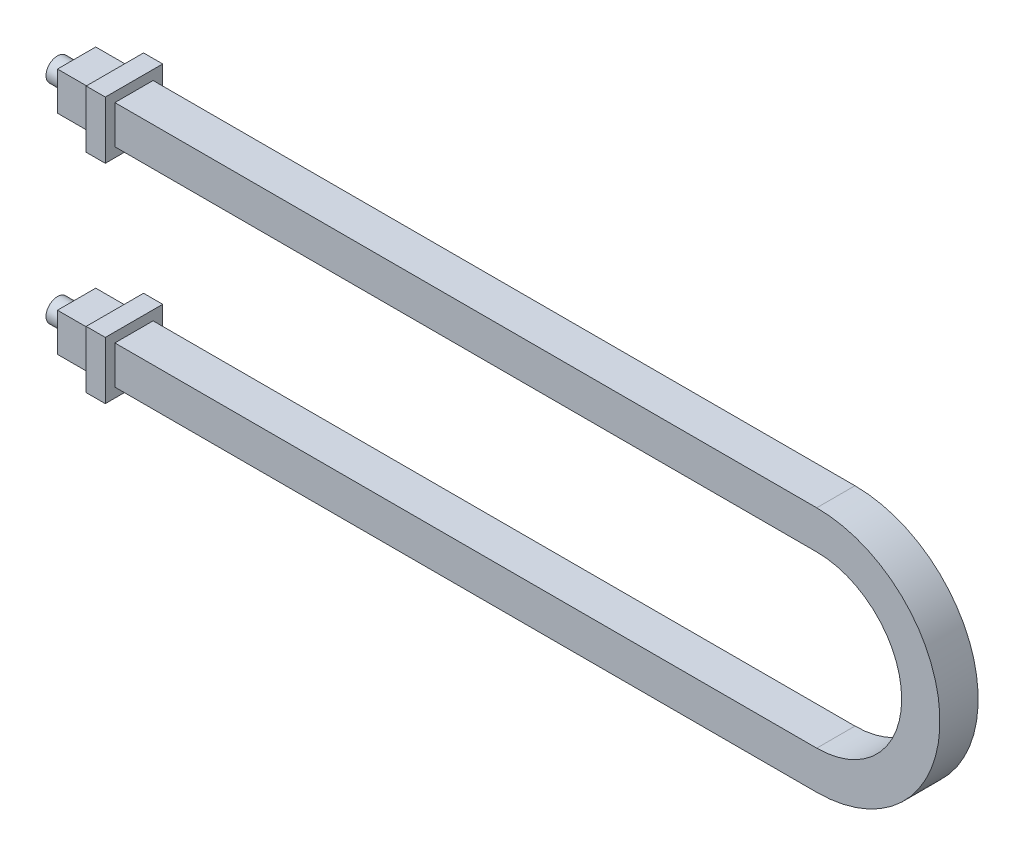
from build123d import *

# Parameters (mm, degrees)
BOSS_EXTRUDE1_DEPTH   = 10
SKETCH2_R             = 3
BOSS_EXTRUDE2_DEPTH   = 15
SKETCH3_R             = 3
BOSS_EXTRUDE3_DEPTH   = 15
SKETCH5_W             = 15
SKETCH5_H             = 15
BOSS_EXTRUDE4_DEPTH   = 5
BOSS_EXTRUDE4_2_DEPTH = 5
SKETCH7_W             = 10
SKETCH7_H             = 10
BOSS_EXTRUDE5_DEPTH   = 10


with BuildPart() as part:
    # Sketch1 → Boss-Extrude1 (new body)
    with BuildSketch(Plane.XY):
        with BuildLine():
            Line((0, 0), (188.467924539, 0))
            ThreePointArc((188.467924539, 0), (220.672766762, -32.204842223), (188.467924539, -64.409684446))
            Line((188.467924539, -64.409684446), (0, -64.409684446))
            Line((0, -64.409684446), (0, -54.409684446))
            Line((0, -54.409684446), (188.467924539, -54.409684446))
            ThreePointArc((188.467924539, -54.409684446), (210.672766762, -32.204842223), (188.467924539, -10))
            Line((188.467924539, -10), (0, -10))
            Line((0, -10), (0, 0))
        make_face()
    extrude(amount=BOSS_EXTRUDE1_DEPTH)

    # Sketch2 → Boss-Extrude2 (add)
    with BuildSketch(Plane.ZY):
        with Locations(Location((5, -4.906979909, 0), (0, 0, 180))):
            Circle(SKETCH2_R)
    extrude(amount=BOSS_EXTRUDE2_DEPTH)



with BuildPart() as body_2:
    # Sketch3 → Boss-Extrude3 (new body)
    with BuildSketch(Plane.ZY):
        with Locations((5, -59.409684446)):
            Circle(SKETCH3_R)
    extrude(amount=BOSS_EXTRUDE3_DEPTH)


with BuildPart() as body_3:
    # Sketch5 → Boss-Extrude4 (new body)
    with BuildSketch(Plane(origin=(0, 0, 0), x_dir=(0, 0, -1), z_dir=(1, 0, 0))):
        with Locations((-5, -59.409684446)):
            Rectangle(SKETCH5_W, SKETCH5_H)
    extrude(amount=BOSS_EXTRUDE4_DEPTH)


with BuildPart() as body_4:
    # Sketch5 → Boss-Extrude4 2 (new body)
    with BuildSketch(Plane(origin=(0, 0, 0), x_dir=(0, 0, -1), z_dir=(1, 0, 0))):
        with Locations((-5, -5)):
            Rectangle(SKETCH5_W, SKETCH5_H)
    extrude(amount=BOSS_EXTRUDE4_2_DEPTH)


with BuildPart() as part_1:
    add(part.part)

    add(body_2.part)  # Boss-Extrude5 merges body 2

    add(body_3.part)  # Boss-Extrude5 merges body 3

    add(body_4.part)  # Boss-Extrude5 merges body 4
    # Sketch7 → Boss-Extrude5 (add)
    with BuildSketch(Plane.ZY):
        with Locations((5, -59.502704537)):
            Rectangle(SKETCH7_W, SKETCH7_H)
        with Locations((5, -4.906979909)):
            Rectangle(SKETCH7_W, SKETCH7_H)
    extrude(amount=BOSS_EXTRUDE5_DEPTH)


solid = part_1.part
